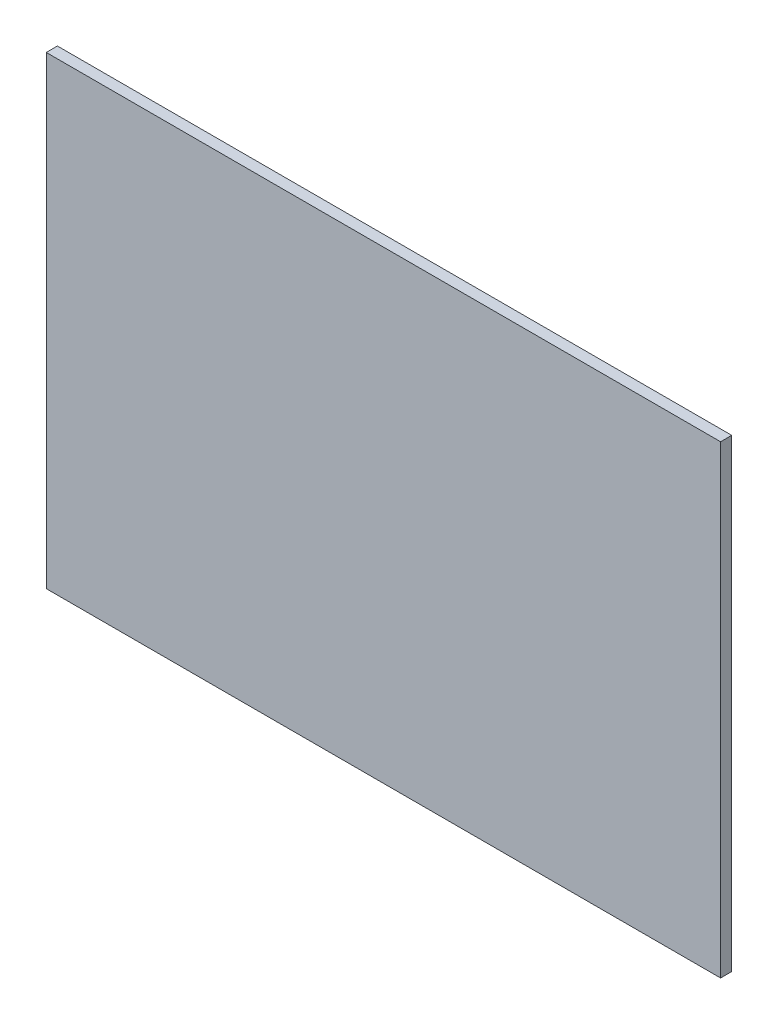
from build123d import *

# Parameters (mm, degrees)
SKETCH1_W           = 726
SKETCH1_H           = 500
BOSS_EXTRUDE1_DEPTH = 12


with BuildPart() as part:
    # Sketch1 → Boss-Extrude1 (new body)
    with BuildSketch(Plane.XY):
        Rectangle(SKETCH1_W, SKETCH1_H)
    extrude(amount=BOSS_EXTRUDE1_DEPTH)


solid = part.part
